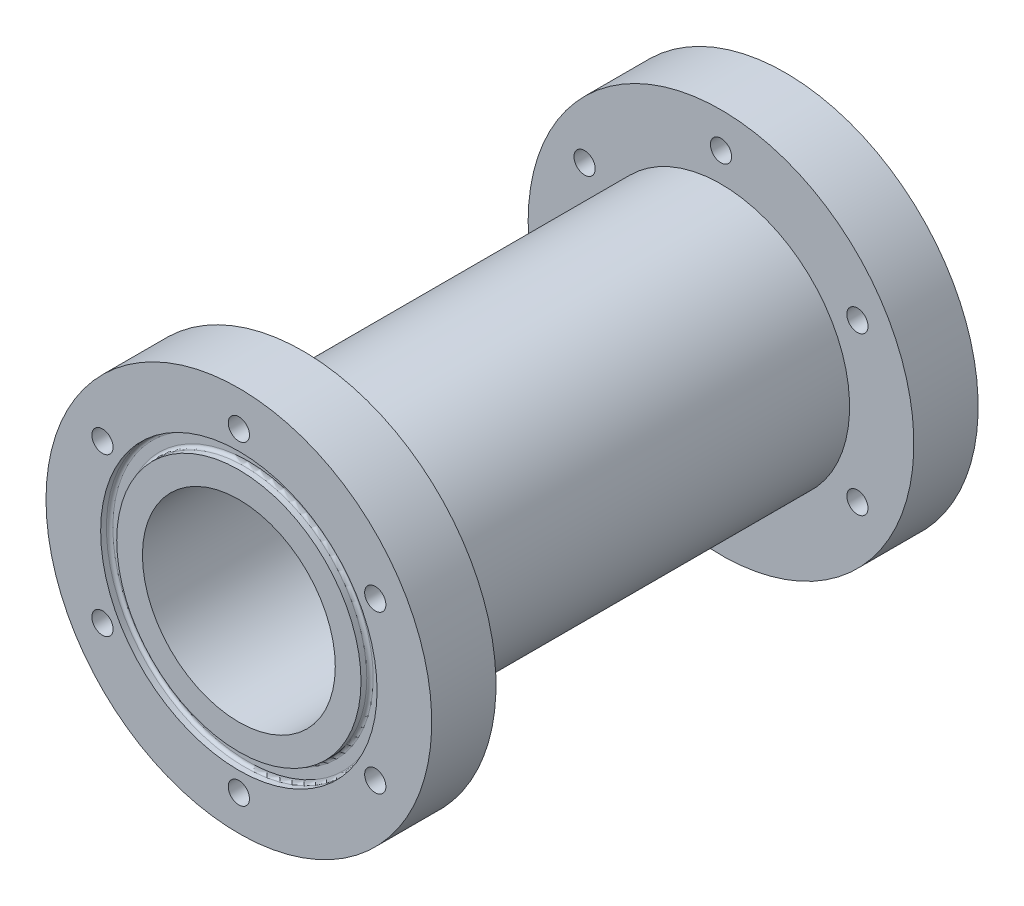
from build123d import *

# Parameters (mm, degrees)
SKETCH1_R            = 20
SKETCH1_R_2          = 15
BOSS_EXTRUDE1_DEPTH  = 42.5
BOSS_EXTRUDE2_START  = -10
SKETCH2_R            = 30
SKETCH2_R_2          = 20
BOSS_EXTRUDE2_DEPTH  = 10
M4_TAPPED_HOLE1_D    = 3.3
CIRPATTERN1_COUNT    = 6
SKETCH5_R            = 21.5
SKETCH5_R_2          = 19
CUT_EXTRUDE1_DEPTH   = 1.4
FILLET1_R            = 0.5
MIRROR1_COPY_1_D     = 3.3
MIRROR1_COPY_2_D     = 3.3
MIRROR1_COPY_3_D     = 3.3
MIRROR1_COPY_4_D     = 3.3
MIRROR1_COPY_5_D     = 3.3
FILLET1_OF_MIRROR1_R = 0.5


with BuildPart() as part:
    # Sketch1 → Boss-Extrude1 (new, symmetric)
    with BuildSketch(Plane.XY):
        Circle(SKETCH1_R)
        Circle(SKETCH1_R_2, mode=Mode.SUBTRACT)
    extrude(amount=BOSS_EXTRUDE1_DEPTH, both=True)

    # Sketch2 → Boss-Extrude2 (add)
    with BuildSketch(Plane(origin=(0, 0, -42.5), x_dir=(-1, 0, 0), z_dir=(0, 0, -1)).offset(BOSS_EXTRUDE2_START)):
        Circle(SKETCH2_R)
        Circle(SKETCH2_R_2, mode=Mode.SUBTRACT)
    boss_extrude2 = extrude(amount=BOSS_EXTRUDE2_DEPTH)

    # M4 Tapped Hole1 (through all)
    with Locations(Plane(origin=(0, 0, -42.5), x_dir=(-1, 0, 0), z_dir=(0, 0, -1))):
        with Locations((0, 24.5)):
            m4_tapped_hole1 = Hole(M4_TAPPED_HOLE1_D / 2)

    # CirPattern1: M4 Tapped Hole1 ×6 about axis
    cirpattern1_axis = Axis((0, 0, 0), (0, 0, 1))
    for i in range(1, CIRPATTERN1_COUNT):
        add(m4_tapped_hole1.rotate(cirpattern1_axis, i * 360 / CIRPATTERN1_COUNT), mode=Mode.SUBTRACT)

    # Sketch5 → Cut-Extrude1 (cut)
    with BuildSketch(Plane(origin=(0, 0, -42.5), x_dir=(-1, 0, 0), z_dir=(0, 0, -1))):
        Circle(SKETCH5_R)
        Circle(SKETCH5_R_2, mode=Mode.SUBTRACT)
    cut_extrude1 = extrude(amount=-CUT_EXTRUDE1_DEPTH, mode=Mode.SUBTRACT)

    # Fillet1
    fillet1_edges = [part.edges().sort_by_distance(p)[0] for p in [
        (21.5, 0, -41.1),
        (19, 0, -41.1),
    ]]
    fillet(fillet1_edges, radius=FILLET1_R)

    # Mirror1: Boss-Extrude2, M4 Tapped Hole1, Cut-Extrude1 across plane
    add(boss_extrude2.mirror(Plane.XY))
    add(m4_tapped_hole1.mirror(Plane.XY), mode=Mode.SUBTRACT)
    add(cut_extrude1.mirror(Plane.XY), mode=Mode.SUBTRACT)

    # Mirror1 copy 1 (through all)
    with Locations(Plane(origin=(0, 0, 42.5), x_dir=(-0.5000000000000001, -0.8660254037844386, 0), z_dir=(0, 0, 1))):
        with Locations((0, -24.5)):
            Hole(MIRROR1_COPY_1_D / 2)

    # Mirror1 copy 2 (through all)
    with Locations(Plane(origin=(0, 0, 42.5), x_dir=(0.4999999999999998, -0.8660254037844387, 0), z_dir=(0, 0, 1))):
        with Locations((0, -24.5)):
            Hole(MIRROR1_COPY_2_D / 2)

    # Mirror1 copy 3 (through all)
    with Locations(Plane.XY.offset(42.5)):
        with Locations((0, -24.5)):
            Hole(MIRROR1_COPY_3_D / 2)

    # Mirror1 copy 4 (through all)
    with Locations(Plane(origin=(0, 0, 42.5), x_dir=(0.5000000000000004, 0.8660254037844384, 0), z_dir=(0, 0, 1))):
        with Locations((0, -24.5)):
            Hole(MIRROR1_COPY_4_D / 2)

    # Mirror1 copy 5 (through all)
    with Locations(Plane(origin=(0, 0, 42.5), x_dir=(-0.5000000000000001, 0.8660254037844386, 0), z_dir=(0, 0, 1))):
        with Locations((0, -24.5)):
            Hole(MIRROR1_COPY_5_D / 2)

    # Fillet1 of Mirror1
    fillet1_of_mirror1_edges = [part.edges().sort_by_distance(p)[0] for p in [
        (21.5, 0, 41.1),
        (19, 0, 41.1),
    ]]
    fillet(fillet1_of_mirror1_edges, radius=FILLET1_OF_MIRROR1_R)


solid = part.part
